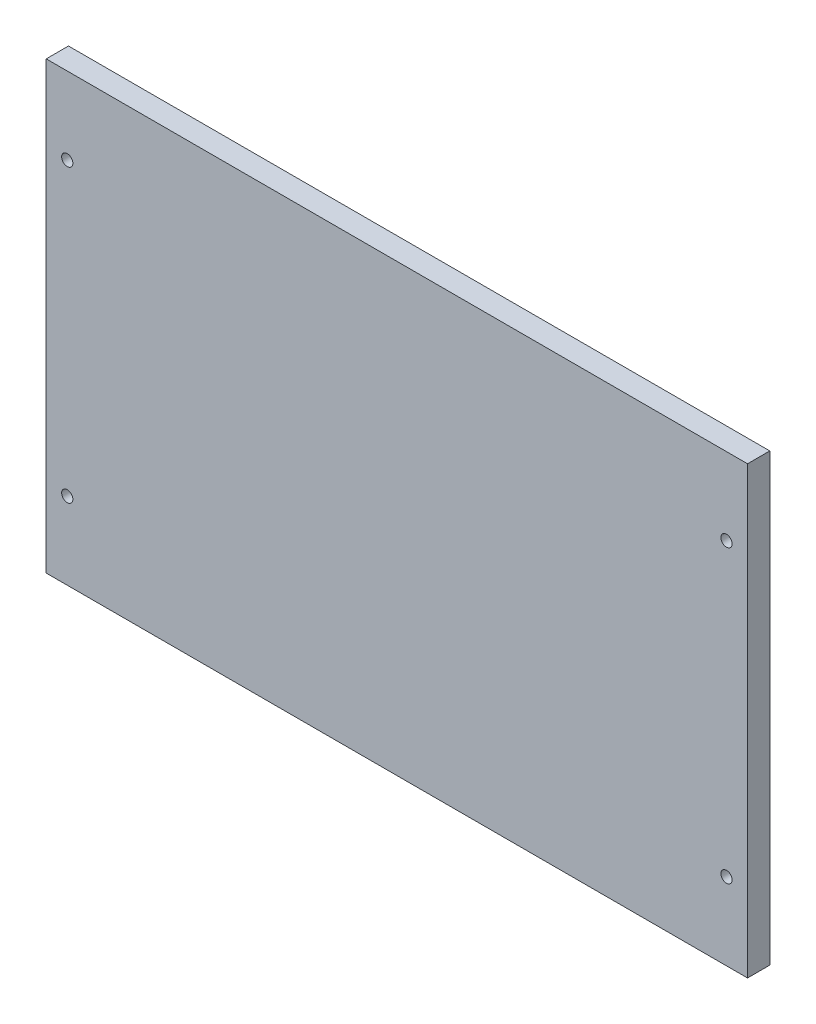
from build123d import *

# Parameters (mm, degrees)
SKETCH1_W  = 200
SKETCH1_H  = 127
SKETCH1_R  = 1.6
WALL_DEPTH = 6.35


with BuildPart() as part:
    # Sketch1 → Wall (new body)
    with BuildSketch(Plane.XY):
        with Locations((100, 63.5)):
            Rectangle(SKETCH1_W, SKETCH1_H)
        with Locations((6, 105)):
            Circle(SKETCH1_R, mode=Mode.SUBTRACT)
        with Locations((194, 105)):
            Circle(SKETCH1_R, mode=Mode.SUBTRACT)
        with Locations((194, 22)):
            Circle(SKETCH1_R, mode=Mode.SUBTRACT)
        with Locations((6, 22)):
            Circle(SKETCH1_R, mode=Mode.SUBTRACT)
    extrude(amount=WALL_DEPTH)


solid = part.part
